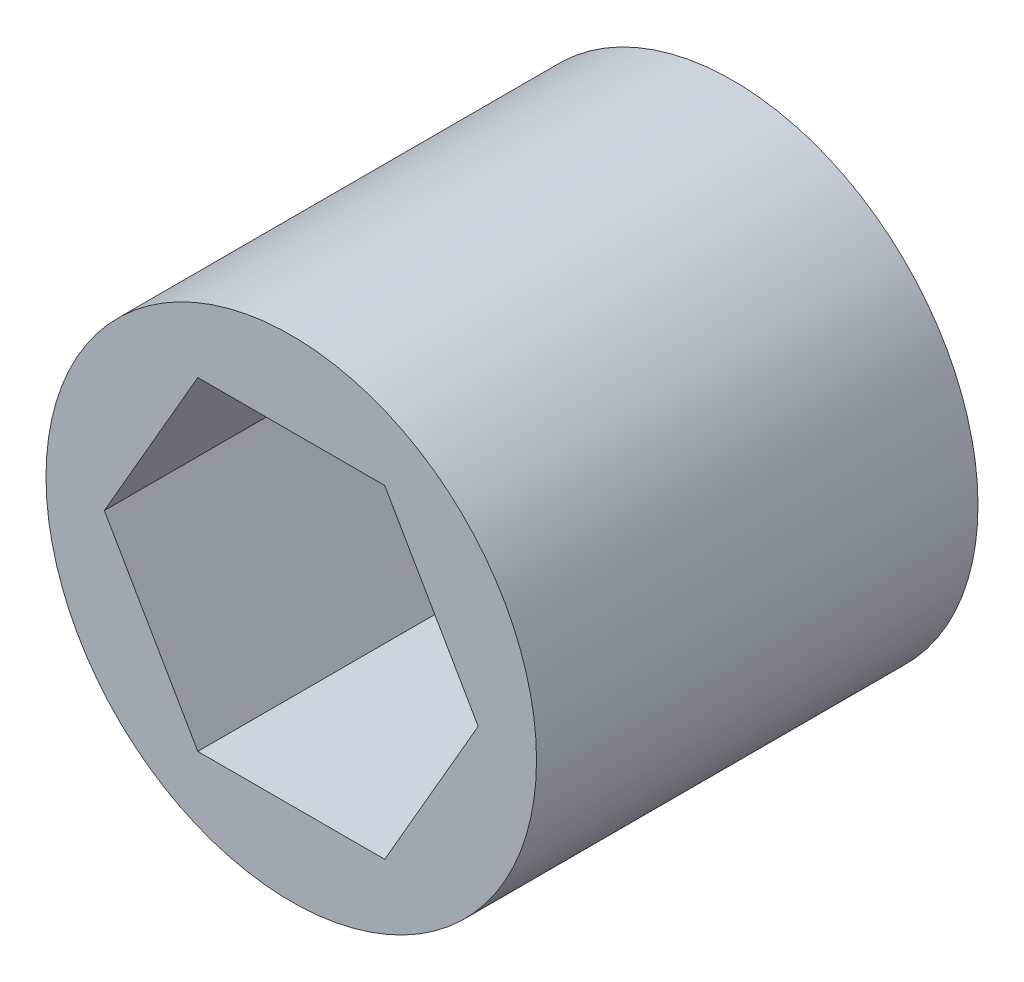
from build123d import *

# Parameters (mm, degrees)
SKETCH1_R           = 10
BOSS_EXTRUDE1_DEPTH = 18


with BuildPart() as part:
    # Sketch1 → Boss-Extrude1 (new body)
    with BuildSketch(Plane.XY):
        Circle(SKETCH1_R)
        Polygon((-7.621023553, 0), (-3.810511777, -6.6), (3.810511777, -6.6), (7.621023553, 0), (3.810511777, 6.6), (-3.810511777, 6.6), align=None, mode=Mode.SUBTRACT)
    extrude(amount=BOSS_EXTRUDE1_DEPTH)


solid = part.part
